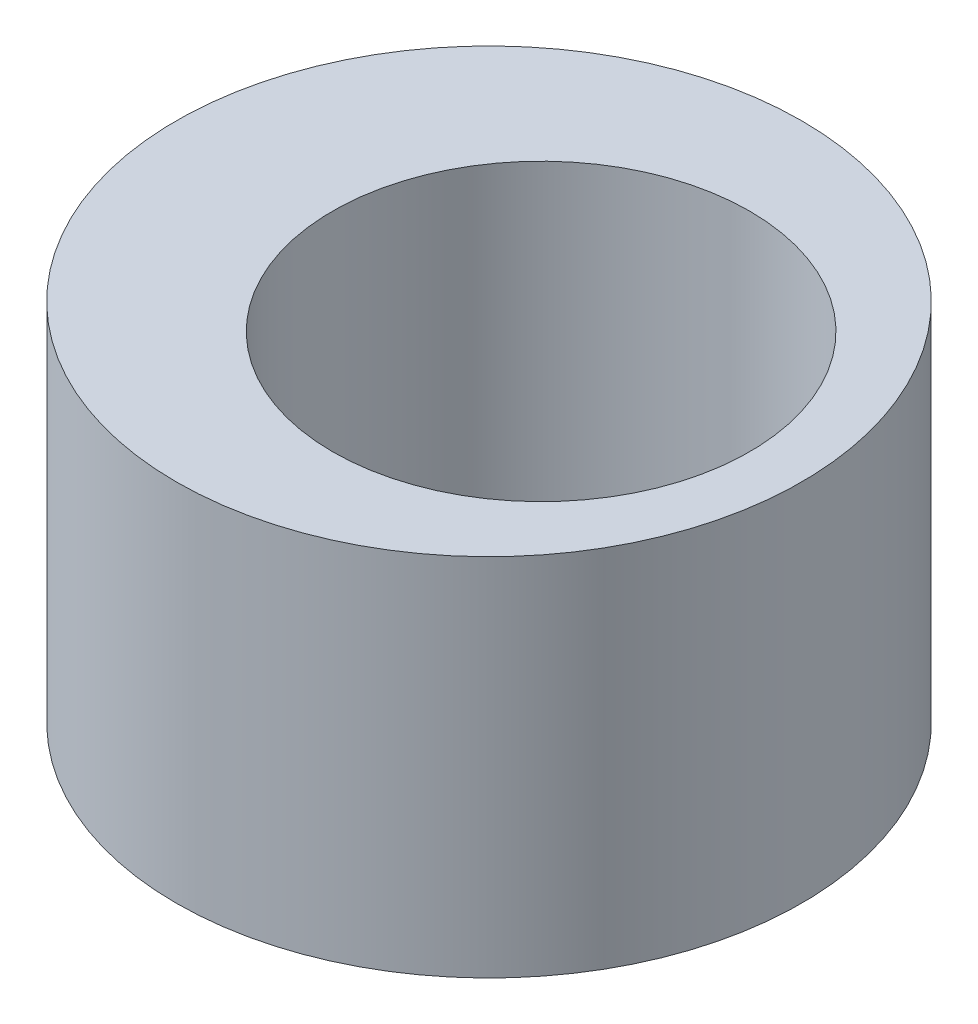
from build123d import *

# Parameters (mm, degrees)
SKETCH1_R           = 6
SKETCH1_R_2         = 4
BOSS_EXTRUDE1_DEPTH = 7


with BuildPart() as part:
    # Sketch1 → Boss-Extrude1 (new body)
    with BuildSketch(Plane(origin=(0, 0, 0), x_dir=(1, 0, 0), z_dir=(0, 1, 0))):
        with Locations(Location((0, 0, 0), (0, 0, 270))):
            Circle(SKETCH1_R)
        with Locations(Location((1, 0, 0), (0, 0, 270))):
            Circle(SKETCH1_R_2, mode=Mode.SUBTRACT)
    extrude(amount=BOSS_EXTRUDE1_DEPTH)


solid = part.part
